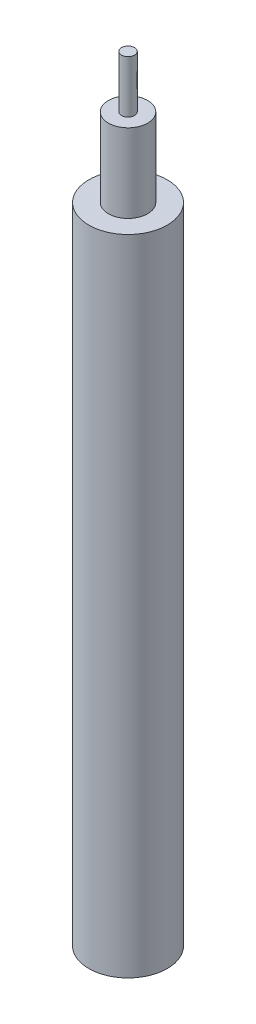
from build123d import *

# Parameters (mm, degrees)
SKETCH1_R           = 2.38125
BOSS_EXTRUDE1_DEPTH = 9.525
SKETCH2_R           = 4.7625
BOSS_EXTRUDE2_DEPTH = 78.105
SKETCH3_R           = 0.79375
BOSS_EXTRUDE3_DEPTH = 6.35


with BuildPart() as part:
    # Sketch1 → Boss-Extrude1 (new body)
    with BuildSketch(Plane(origin=(0, 0, 0), x_dir=(1, 0, 0), z_dir=(0, 1, 0))):
        with Locations(Location((0, 0, 0), (0, 0, 270))):
            Circle(SKETCH1_R)
    extrude(amount=-BOSS_EXTRUDE1_DEPTH)

    # Sketch2 → Boss-Extrude2 (add)
    with BuildSketch(Plane(origin=(0, -9.525, 0), x_dir=(-1, 0, 0), z_dir=(0, -1, 0))):
        with Locations(Location((0, 0, 0), (0, 0, 90))):
            Circle(SKETCH2_R)
    extrude(amount=BOSS_EXTRUDE2_DEPTH)

    # Sketch3 → Boss-Extrude3 (add)
    with BuildSketch(Plane(origin=(0, 0, 0), x_dir=(1, 0, 0), z_dir=(0, 1, 0))):
        with Locations(Location((0, 0, 0), (0, 0, 270))):
            Circle(SKETCH3_R)
    extrude(amount=BOSS_EXTRUDE3_DEPTH)


solid = part.part
